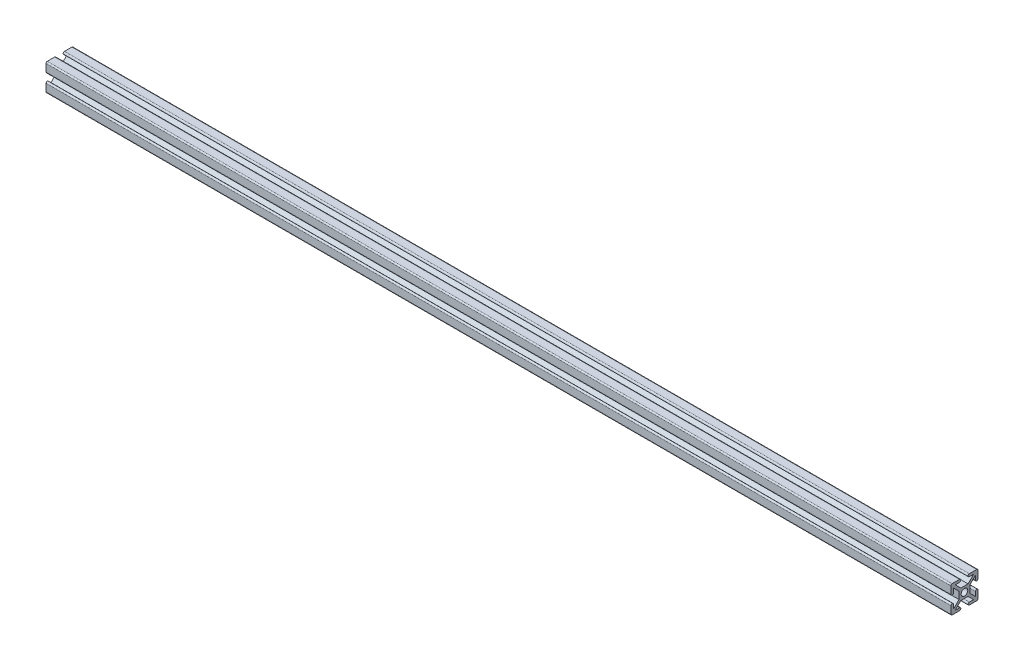
from build123d import *

# Parameters (mm, degrees)
CROQUIS1_R              = 3.645
SALIENTE_EXTRUIR1_DEPTH = 1000
SKETCH1_R               = 5
CUT_EXTRUDE1_DEPTH      = 12
SKETCH2_R               = 5
CUT_EXTRUDE2_DEPTH      = 12
SKETCH3_R               = 4
CUT_EXTRUDE3_DEPTH      = 12
SKETCH5_R               = 4
CUT_EXTRUDE4_DEPTH      = 12


with BuildPart() as part:
    # Croquis1 → Saliente-Extruir1 (new body)
    with BuildSketch(Plane(origin=(0, 0, 0), x_dir=(0, 0, -1), z_dir=(1, 0, 0))):
        with BuildLine():
            Line((-16.251548735, 7.406501548), (-11.526548735, 7.406501548))
            Line((-11.526548735, 7.406501548), (-17.676548735, 13.556501548))
            Line((-17.676548735, 13.556501548), (-25.676548735, 13.556501548))
            Line((-25.676548735, 13.556501548), (-31.826548735, 7.406501548))
            Line((-31.826548735, 7.406501548), (-27.101548735, 7.406501548))
            ThreePointArc((-27.101548735, 7.406501548), (-25.676548735, 5.981501548), (-27.101548735, 4.556501548))
            Line((-27.101548735, 4.556501548), (-35.277984508, 4.58293732))
            ThreePointArc((-35.277984508, 4.58293732), (-36.266918757, 4.992567299), (-36.676548735, 5.981501548))
            Line((-36.676548735, 5.981501548), (-36.676548735, 14.131501548))
            ThreePointArc((-36.676548735, 14.131501548), (-35.277984508, 15.530065775), (-33.879420281, 14.131501548))
            Line((-33.879420281, 14.131501548), (-33.879420281, 9.406501548))
            Line((-33.879420281, 9.406501548), (-27.729420281, 15.556501548))
            Line((-27.729420281, 15.556501548), (-27.729420281, 23.556501548))
            Line((-27.729420281, 23.556501548), (-33.879420281, 29.706501548))
            Line((-33.879420281, 29.706501548), (-33.879420281, 24.981501548))
            ThreePointArc((-33.879420281, 24.981501548), (-35.304420281, 23.556501548), (-36.729420281, 24.981501548))
            Line((-36.729420281, 24.981501548), (-36.729420281, 33.131454958))
            ThreePointArc((-36.729420281, 33.131454958), (-36.312047444, 34.139082121), (-35.304420281, 34.556454958))
            Line((-35.304420281, 34.556454958), (-27.154420281, 34.556454958))
            ThreePointArc((-27.154420281, 34.556454958), (-25.729420281, 33.131454958), (-27.154420281, 31.706454958))
            Line((-27.154420281, 31.706454958), (-31.879420281, 31.706454958))
            Line((-31.879420281, 31.706454958), (-25.729420281, 25.556454958))
            Line((-25.729420281, 25.556454958), (-17.729420281, 25.556454958))
            Line((-17.729420281, 25.556454958), (-11.579420281, 31.706454958))
            Line((-11.579420281, 31.706454958), (-16.304420281, 31.706454958))
            ThreePointArc((-16.304420281, 31.706454958), (-17.729420281, 33.131454958), (-16.304420281, 34.556454958))
            Line((-16.304420281, 34.556454958), (-8.154420281, 34.556454958))
            ThreePointArc((-8.154420281, 34.556454958), (-7.146793118, 34.139082121), (-6.729420281, 33.131454958))
            Line((-6.729420281, 33.131454958), (-6.729420281, 25.085198643))
            ThreePointArc((-6.729420281, 25.085198643), (-8.154420281, 23.660198643), (-9.579420281, 25.085198643))
            Line((-9.579420281, 25.085198643), (-9.579420281, 29.706454958))
            Line((-9.579420281, 29.706454958), (-15.729420281, 23.556454958))
            Line((-15.729420281, 23.556454958), (-15.729420281, 15.556454958))
            Line((-15.729420281, 15.556454958), (-9.579420281, 9.406454958))
            Line((-9.579420281, 9.406454958), (-9.579420281, 14.235198643))
            ThreePointArc((-9.579420281, 14.235198643), (-8.154420281, 15.660198643), (-6.729420281, 14.235198643))
            Line((-6.729420281, 14.235198643), (-6.729420281, 5.981501548))
            ThreePointArc((-6.729420281, 5.981501548), (-7.146793118, 4.973874385), (-8.154420281, 4.556501548))
            Line((-8.154420281, 4.556501548), (-16.251548735, 4.556501548))
            ThreePointArc((-16.251548735, 4.556501548), (-17.676548735, 5.981501548), (-16.251548735, 7.406501548))
        make_face()
        with Locations((-21.676548735, 19.556501548)):
            Circle(CROQUIS1_R, mode=Mode.SUBTRACT)
    extrude(amount=SALIENTE_EXTRUIR1_DEPTH)

    # Sketch1 → Cut-Extrude1 (cut)
    with BuildSketch(Plane.XY.offset(27.729420281)):
        with Locations(Location((425.1, 19.556501548, 0), (0, 0, 53.129212559))):
            Circle(SKETCH1_R)
    extrude(amount=-CUT_EXTRUDE1_DEPTH, mode=Mode.SUBTRACT)

    # Sketch2 → Cut-Extrude2 (cut)
    with BuildSketch(Plane.XZ.offset(-13.556501548)):
        with Locations((425.1, 17.960715983)):
            Circle(SKETCH2_R)
    extrude(amount=-CUT_EXTRUDE2_DEPTH, mode=Mode.SUBTRACT)

    # Sketch3 → Cut-Extrude3 (cut)
    with BuildSketch(Plane.XY.offset(27.729420281)):
        with Locations(Location((325, 19.556501548, 0), (0, 0, 89.723462125))):
            Circle(SKETCH3_R)
    extrude(amount=-CUT_EXTRUDE3_DEPTH, mode=Mode.SUBTRACT)

    # Sketch5 → Cut-Extrude4 (cut)
    with BuildSketch(Plane.XZ.offset(-13.556501548)):
        with Locations(Location((324.348806815, 21.744093492, 0), (0, 0, 227.871078856))):
            Circle(SKETCH5_R)
    extrude(amount=-CUT_EXTRUDE4_DEPTH, mode=Mode.SUBTRACT)


solid = part.part
